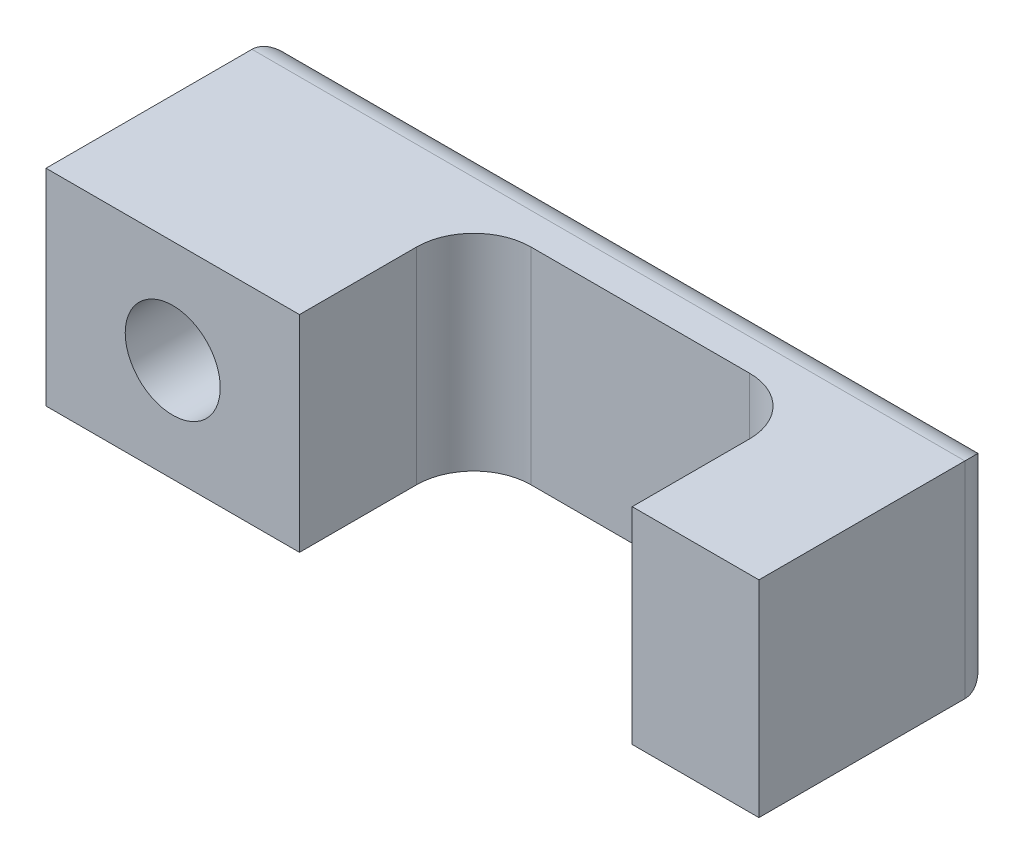
from build123d import *

# Parameters (mm, degrees)
SIDE_W         = 22.5
SIDE_H         = 7.5
SIDE_EX_DEPTH  = 6.5
HOLE_R         = 1.5
HOLE_CUT_DEPTH = 25.591665255
WIRE_CUT_DEPTH = 25.591665255
FILLET1_R      = 1


with BuildPart() as part:
    # Side → Side_Ex (new body)
    with BuildSketch(Plane(origin=(0, 0, 0), x_dir=(1, 0, 0), z_dir=(0, 1, 0))):
        with Locations((11.25, 3.75)):
            Rectangle(SIDE_W, SIDE_H)
    extrude(amount=SIDE_EX_DEPTH)

    # Hole → Hole_Cut (cut, through all)
    with BuildSketch(Plane(origin=(0, 0, -7.5), x_dir=(-1, 0, 0), z_dir=(0, 0, -1))):
        with Locations((-4, 3.25)):
            Circle(HOLE_R)
    extrude(amount=-HOLE_CUT_DEPTH, mode=Mode.SUBTRACT)

    # Wire 2 → Wire_Cut (cut, through all)
    with BuildSketch(Plane(origin=(0, 0, 0), x_dir=(1, 0, 0), z_dir=(0, 1, 0))):
        with BuildLine():
            Line((16.7, 5.5), (9.8, 5.5))
            ThreePointArc((9.8, 5.5), (8.527207794, 4.972792206), (8, 3.7))
            Line((8, 3.7), (8, 0))
            Line((8, 0), (18.5, 0))
            Line((18.5, 0), (18.5, 3.7))
            ThreePointArc((18.5, 3.7), (17.972792206, 4.972792206), (16.7, 5.5))
        make_face()
    extrude(amount=WIRE_CUT_DEPTH, mode=Mode.SUBTRACT)

    # Fillet1
    fillet1_edges = [part.edges().sort_by_distance(p)[0] for p in [
        (11.25, 6.5, -7.5),
        (11.25, 0, -7.5),
        (0, 3.25, -7.5),
        (22.5, 3.25, -7.5),
    ]]
    fillet(fillet1_edges, radius=FILLET1_R)


solid = part.part
